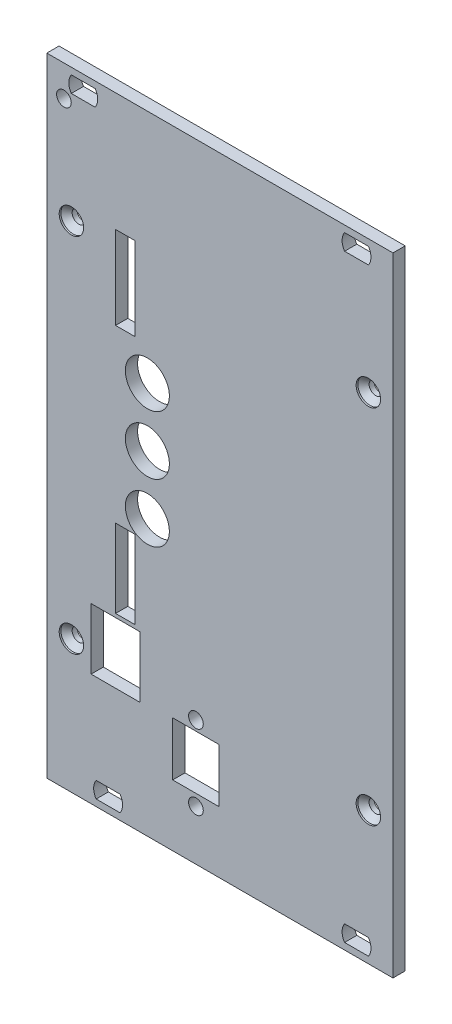
from build123d import *

# Parameters (mm, degrees)
SKETCH1_W                    = 70.78
SKETCH1_H                    = 128.4
BULK_DEPTH                   = 2.5
MOUNT_HOLE_NW_DEPTH          = 141.506579561
MOUNT_HOLES_NE_SE_COUNT      = 2
MOUNT_HOLES_NE_SE_PITCH      = 55.88
MOUNT_HOLES_NE_SE_COUNT_DIR2 = 2
MOUNT_HOLES_NE_SE_PITCH_DIR2 = 122.4
MOUNT_HOLE_SW_DEPTH          = 141.506579561
ALIGNMENT_HOLE_D             = 3
DRILL_HOLES_AT_2_COUNT       = 2
DRILL_HOLES_AT_2_PITCH       = 74
DRILL_HOLES_AT_3_COUNT       = 2
DRILL_HOLES_AT_3_PITCH       = 95.72313409
DRILL_HOLES_AT_4_COUNT       = 2
DRILL_HOLES_AT_4_PITCH       = 60.72
SKETCH9_W                    = 10
SKETCH9_H                    = 12.5
USB_DEPTH                    = 141.506579561
MCXX_DEPTH                   = 141.506579561
SKETCH12_R                   = 4.5
SELECTOR_1_DEPTH             = 141.506579561
COPY_SELECTOR_COUNT          = 3
COPY_SELECTOR_PITCH          = 12
MMCX_2_DEPTH                 = 141.506579561
SKETCH25_R                   = 1.5
SKETCH25_W                   = 9.5
SKETCH25_H                   = 11
BARREL_JACK_DEPTH            = 141.506579561


with BuildPart() as part:
    # Sketch1 → Bulk (new body)
    with BuildSketch(Plane.XY.offset(2.5)):
        with Locations((27.94, 61.2)):
            Rectangle(SKETCH1_W, SKETCH1_H)
    extrude(amount=-BULK_DEPTH)

    # Sketch2 → Mount hole NW (cut, through all)
    with BuildSketch(Plane.XY.offset(2.5)):
        with BuildLine():
            Line((2.445403852, 124.05), (-2.445403852, 124.05))
            ThreePointArc((-2.445403852, 124.05), (-2.95, 122.4), (-2.445403852, 120.75))
            Line((-2.445403852, 120.75), (2.445403852, 120.75))
            ThreePointArc((2.445403852, 120.75), (2.95, 122.4), (2.445403852, 124.05))
        make_face()
    mount_hole_nw = extrude(amount=-MOUNT_HOLE_NW_DEPTH, mode=Mode.SUBTRACT)

    # Mount holes NE SE: Mount hole NW 2 × 2, 1 skipped
    with Locations(*[(i * MOUNT_HOLES_NE_SE_PITCH, -j * MOUNT_HOLES_NE_SE_PITCH_DIR2, 0) for i in range(MOUNT_HOLES_NE_SE_COUNT) for j in range(MOUNT_HOLES_NE_SE_COUNT_DIR2) if (i, j) not in ((0, 0), (0, 1))]):
        add(mount_hole_nw, mode=Mode.SUBTRACT)

    # Sketch3 → Mount hole SW (cut, through all)
    with BuildSketch(Plane.XY.offset(2.5)):
        with BuildLine():
            Line((7.525403852, 1.65), (2.634596148, 1.65))
            ThreePointArc((2.634596148, 1.65), (2.13, 0), (2.634596148, -1.65))
            Line((2.634596148, -1.65), (7.525403852, -1.65))
            ThreePointArc((7.525403852, -1.65), (8.03, 0), (7.525403852, 1.65))
        make_face()
    extrude(amount=-MOUNT_HOLE_SW_DEPTH, mode=Mode.SUBTRACT)

    # Alignment hole (through all)
    with Locations(Plane.XY.offset(2.5)):
        with Locations((-3.95, 119.1)):
            Hole(ALIGNMENT_HOLE_D / 2)

    # Sketch7 → Drill holes (revolve, cut)
    with BuildSketch(Plane(origin=(-2.42, 24.2, 2.5), x_dir=(0, -1, 0), z_dir=(1, 0, 0))):
        Polygon((0, 0), (0, 2.5), (1.35, 2.5), (1.35, 1.5), (2.5, 0.35), (2.5, 0), align=None)
    drill_holes = revolve(axis=Axis((-2.42, 24.2, 8.85), (0, 0, -1)), mode=Mode.SUBTRACT)

    # Drill holes at 2: Drill holes ×2
    with Locations(*[(0, i * DRILL_HOLES_AT_2_PITCH, 0) for i in range(1, DRILL_HOLES_AT_2_COUNT)]):
        add(drill_holes, mode=Mode.SUBTRACT)

    # Drill holes at 3: Drill holes ×2
    with Locations(*[Vector(0.6343294186643587, 0.7730628620086059, 0) * (i * DRILL_HOLES_AT_3_PITCH) for i in range(1, DRILL_HOLES_AT_3_COUNT)]):
        add(drill_holes, mode=Mode.SUBTRACT)

    # Drill holes at 4: Drill holes ×2
    with Locations(*[(i * DRILL_HOLES_AT_4_PITCH, 0, 0) for i in range(1, DRILL_HOLES_AT_4_COUNT)]):
        add(drill_holes, mode=Mode.SUBTRACT)

    # Sketch9 → USB (cut, through all)
    with BuildSketch(Plane.XY.offset(2.5)):
        with Locations((6.61, 26.2)):
            Rectangle(SKETCH9_W, SKETCH9_H)
    extrude(amount=-USB_DEPTH, mode=Mode.SUBTRACT)

    # Sketch10 → MCXX (cut, through all)
    with BuildSketch(Plane.XY.offset(2.5)):
        Polygon((6.61, 49.2), (6.61, 37.2), (6.61, 33.2), (10.61, 33.2), (10.61, 37.2), (10.61, 49.2), align=None)
    extrude(amount=-MCXX_DEPTH, mode=Mode.SUBTRACT)

    # Sketch12 → Selector 1 (cut, through all)
    with BuildSketch(Plane.XY.offset(2.5)):
        with Locations((13.11, 53.2)):
            Circle(SKETCH12_R)
    selector_1 = extrude(amount=-SELECTOR_1_DEPTH, mode=Mode.SUBTRACT)

    # Copy selector: Selector 1 ×3
    with Locations(*[(0, i * COPY_SELECTOR_PITCH, 0) for i in range(1, COPY_SELECTOR_COUNT)]):
        add(selector_1, mode=Mode.SUBTRACT)

    # Sketch27 → MMCX 2 (cut, through all)
    with BuildSketch(Plane.XY.offset(2.5)):
        Polygon((6.61, 101.2), (6.61, 88.2), (6.61, 84.2), (10.61, 84.2), (10.61, 88.2), (10.61, 101.2), align=None)
    extrude(amount=-MMCX_2_DEPTH, mode=Mode.SUBTRACT)

    # Sketch25 → Barrel Jack (cut, through all)
    with BuildSketch(Plane.XY.offset(2.5)):
        with Locations((23.043898983, 22.557406324)):
            Circle(SKETCH25_R)
        with Locations((23.043898983, 7.257406324)):
            Circle(SKETCH25_R)
        with Locations((23.043898983, 15.057406324)):
            Rectangle(SKETCH25_W, SKETCH25_H)
    extrude(amount=-BARREL_JACK_DEPTH, mode=Mode.SUBTRACT)


solid = part.part
